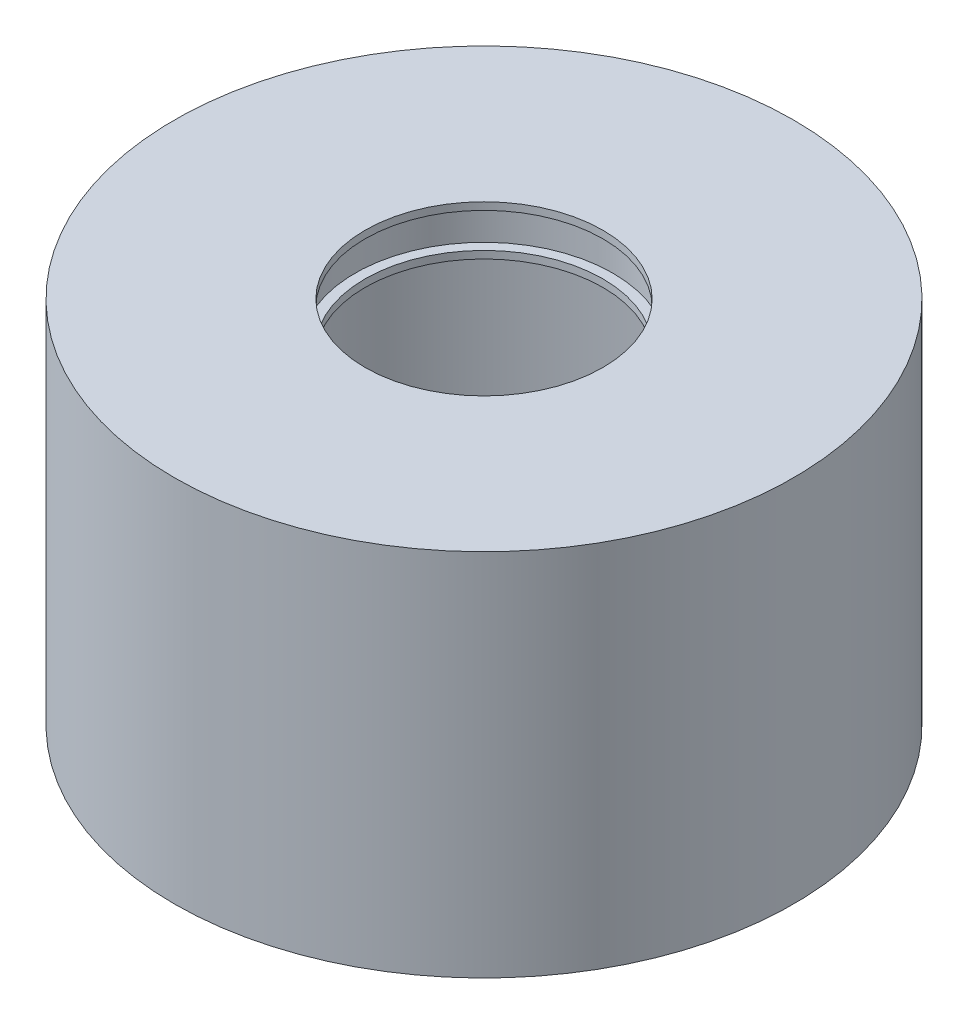
from build123d import *
from build123d.topology import SkipClean

# Parameters (mm, degrees)
CUT_EXTRUDE5_START = -2.5
SKETCH3_R          = 2
CUT_EXTRUDE5_DEPTH = 50


with BuildPart() as part:
    # Sketch2 → Revolve1 (revolve)
    with BuildSketch(Plane(origin=(0, 0, 0), x_dir=(0, 0, -1), z_dir=(1, 0, 0))):
        Polygon((47.5, -37.25), (62.5, -37.25), (62.5, 37.25), (24, 37.25), (24, 35.75), (26, 35.75), (26, 28.75), (24, 28.75), (24, 27.25), (47.5, 27.25), (53, 21.75), (53, -18.75), (47.5, -24.25), (47.5, -25.75), (50, -25.75), (50, -35.75), (47.5, -35.75), align=None)
    revolve(axis=Axis((0, -15.437269333, 0), (0, 1, 0)))

    # Sketch3 → Cut-Extrude5 (cut)
    with SkipClean():  # the faces are left unmerged after this step: merging them gives an invalid solid
        with BuildSketch(Plane.XZ.offset(25.75).offset(CUT_EXTRUDE5_START)):
            with Locations((-47.290862085, 16.234973459)):
                Circle(SKETCH3_R)
            with Locations((-39.959399845, 30.054057363)):
                Circle(SKETCH3_R)
            with Locations((-28.716433135, 40.931240734)):
                Circle(SKETCH3_R)
            with Locations((-14.66250187, 47.801789076)):
                Circle(SKETCH3_R)
            with Locations((0.826697237, 49.99316525)):
                Circle(SKETCH3_R)
            with Locations((16.234973459, 47.290862085)):
                Circle(SKETCH3_R)
            with Locations((30.054057363, 39.959399845)):
                Circle(SKETCH3_R)
            with Locations((40.931240734, 28.716433135)):
                Circle(SKETCH3_R)
            with Locations((47.801789076, 14.66250187)):
                Circle(SKETCH3_R)
            with Locations((49.99316525, -0.826697237)):
                Circle(SKETCH3_R)
            with Locations((47.290862085, -16.234973459)):
                Circle(SKETCH3_R)
            with Locations((39.959399845, -30.054057363)):
                Circle(SKETCH3_R)
            with Locations((28.716433135, -40.931240734)):
                Circle(SKETCH3_R)
            with Locations((14.66250187, -47.801789076)):
                Circle(SKETCH3_R)
            with Locations((-0.826697237, -49.99316525)):
                Circle(SKETCH3_R)
            with Locations((-16.234973459, -47.290862085)):
                Circle(SKETCH3_R)
            with Locations((-30.054057363, -39.959399845)):
                Circle(SKETCH3_R)
            with Locations((-40.931240734, -28.716433135)):
                Circle(SKETCH3_R)
            with Locations((-47.801789076, -14.66250187)):
                Circle(SKETCH3_R)
            with Locations((-49.99316525, 0.826697237)):
                Circle(SKETCH3_R)
        extrude(amount=-CUT_EXTRUDE5_DEPTH, mode=Mode.SUBTRACT)


solid = part.part
